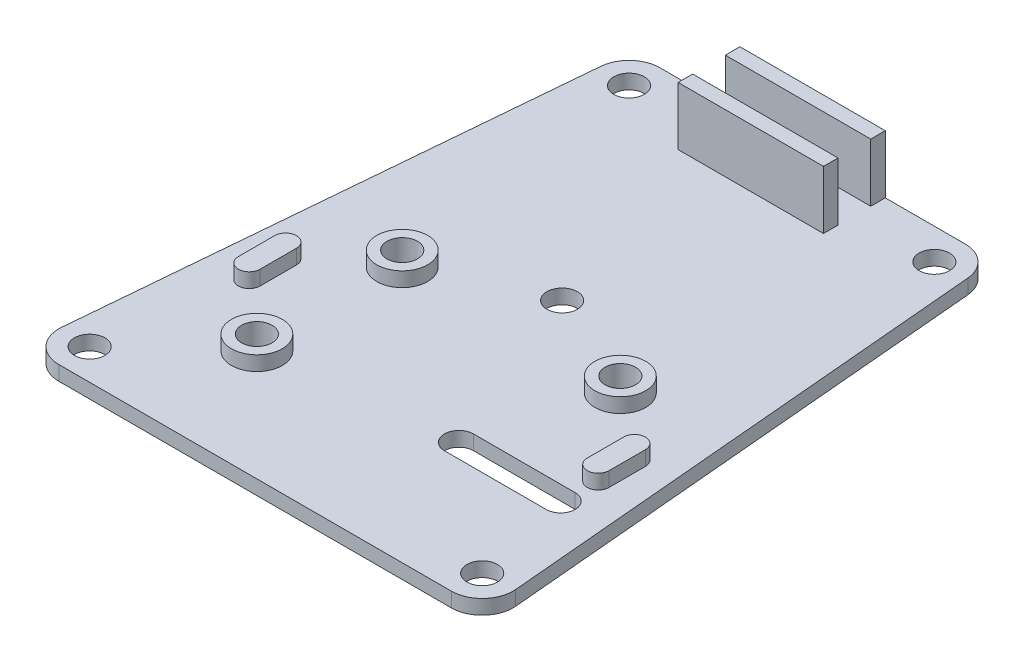
from build123d import *

# Parameters (mm, degrees)
CROQUIS1_R              = 2.1
SALIENTE_EXTRUIR1_DEPTH = 2
CROQUIS2_W              = 20
CROQUIS2_H              = 2
SALIENTE_EXTRUIR2_DEPTH = 8
CROQUIS3_R              = 3.5
CROQUIS3_R_2            = 2.1
SALIENTE_EXTRUIR3_DEPTH = 2


with BuildPart() as part:
    # Croquis1 → Saliente-Extruir1 (new body)
    with BuildSketch(Plane(origin=(0, 0, 0), x_dir=(1, 0, 0), z_dir=(0, 1, 0))):
        with BuildLine():
            Line((-21, 4.25), (21, 4.25))
            ThreePointArc((21, 4.25), (23.870499774, 3.134123649), (25.233647636, 0.372461669))
            Line((25.233647636, 0.372461669), (31.233647636, -67.827538331))
            ThreePointArc((31.233647636, -67.827538331), (30.134123649, -71.070499774), (27, -72.45))
            Line((27, -72.45), (-27, -72.45))
            ThreePointArc((-27, -72.45), (-30.134123649, -71.070499774), (-31.233647636, -67.827538331))
            Line((-31.233647636, -67.827538331), (-25.233647636, 0.372461669))
            ThreePointArc((-25.233647636, 0.372461669), (-23.870499774, 3.134123649), (-21, 4.25))
        make_face()
        with Locations(Location((-21, 0, 0), (0, 0, 270))):
            Circle(CROQUIS1_R, mode=Mode.SUBTRACT)
        with Locations(Location((21, 0, 0), (0, 0, 90))):
            Circle(CROQUIS1_R, mode=Mode.SUBTRACT)
        with Locations(Location((0, -30.2, 0), (0, 0, 270))):
            Circle(CROQUIS1_R, mode=Mode.SUBTRACT)
        with Locations(Location((-27, -68.2, 0), (0, 0, 270))):
            Circle(CROQUIS1_R, mode=Mode.SUBTRACT)
        with Locations(Location((27, -68.2, 0), (0, 0, 270))):
            Circle(CROQUIS1_R, mode=Mode.SUBTRACT)
        with Locations(Location((-15, -37.2, 0), (0, 0, 270))):
            Circle(CROQUIS1_R, mode=Mode.SUBTRACT)
        with Locations(Location((-15, -57.2, 0), (0, 0, 270))):
            Circle(CROQUIS1_R, mode=Mode.SUBTRACT)
        with Locations(Location((15, -37.2, 0), (0, 0, 270))):
            Circle(CROQUIS1_R, mode=Mode.SUBTRACT)
        with BuildLine():
            Line((9.8, -52.2), (23.8, -52.2))
            ThreePointArc((23.8, -52.2), (25.8, -54.2), (23.8, -56.2))
            Line((23.8, -56.2), (9.8, -56.2))
            ThreePointArc((9.8, -56.2), (7.8, -54.2), (9.8, -52.2))
        make_face(mode=Mode.SUBTRACT)
    extrude(amount=SALIENTE_EXTRUIR1_DEPTH)

    # Croquis2 → Saliente-Extruir2 (add)
    with BuildSketch(Plane(origin=(0, 2, 0), x_dir=(1, 0, 0), z_dir=(0, 1, 0))):
        with Locations((0, -3.25)):
            Rectangle(CROQUIS2_W, CROQUIS2_H)
        with Locations((0, 3.25)):
            Rectangle(CROQUIS2_W, CROQUIS2_H)
    extrude(amount=SALIENTE_EXTRUIR2_DEPTH)

    # Croquis3 → Saliente-Extruir3 (add)
    # profile 1 of 5: a face of its own
    with BuildSketch(Plane(origin=(0, 2, 0), x_dir=(1, 0, 0), z_dir=(0, 1, 0))):
        with Locations(Location((15, -37.2, 0), (0, 0, 270))):
            Circle(CROQUIS3_R)
        with Locations(Location((15, -37.2, 0), (0, 0, 270))):
            Circle(CROQUIS3_R_2, mode=Mode.SUBTRACT)
    # profile 2 of 5: a face of its own
    with BuildSketch(Plane(origin=(0, 2, 0), x_dir=(1, 0, 0), z_dir=(0, 1, 0))):
        with Locations(Location((-15, -37.2, 0), (0, 0, 270))):
            Circle(CROQUIS3_R)
        with Locations(Location((-15, -37.2, 0), (0, 0, 270))):
            Circle(CROQUIS3_R_2, mode=Mode.SUBTRACT)
    # profile 3 of 5: a face of its own
    with BuildSketch(Plane(origin=(0, 2, 0), x_dir=(1, 0, 0), z_dir=(0, 1, 0))):
        with Locations(Location((-15, -57.2, 0), (0, 0, 270))):
            Circle(CROQUIS3_R)
        with Locations(Location((-15, -57.2, 0), (0, 0, 270))):
            Circle(CROQUIS3_R_2, mode=Mode.SUBTRACT)
    # profile 4 of 5: a face of its own
    with BuildSketch(Plane(origin=(0, 2, 0), x_dir=(1, 0, 0), z_dir=(0, 1, 0))):
        with BuildLine():
            Line((-25.5, -44.25), (-25.5, -49.25))
            ThreePointArc((-25.5, -49.25), (-24, -50.75), (-22.5, -49.25))
            Line((-22.5, -49.25), (-22.5, -44.25))
            ThreePointArc((-22.5, -44.25), (-24, -42.75), (-25.5, -44.25))
        make_face()
    # profile 5 of 5: a face of its own
    with BuildSketch(Plane(origin=(0, 2, 0), x_dir=(1, 0, 0), z_dir=(0, 1, 0))):
        with BuildLine():
            Line((22.5, -44.25), (22.5, -49.25))
            ThreePointArc((22.5, -49.25), (24, -50.75), (25.5, -49.25))
            Line((25.5, -49.25), (25.5, -44.25))
            ThreePointArc((25.5, -44.25), (24, -42.75), (22.5, -44.25))
        make_face()
    extrude(amount=SALIENTE_EXTRUIR3_DEPTH)


solid = part.part
